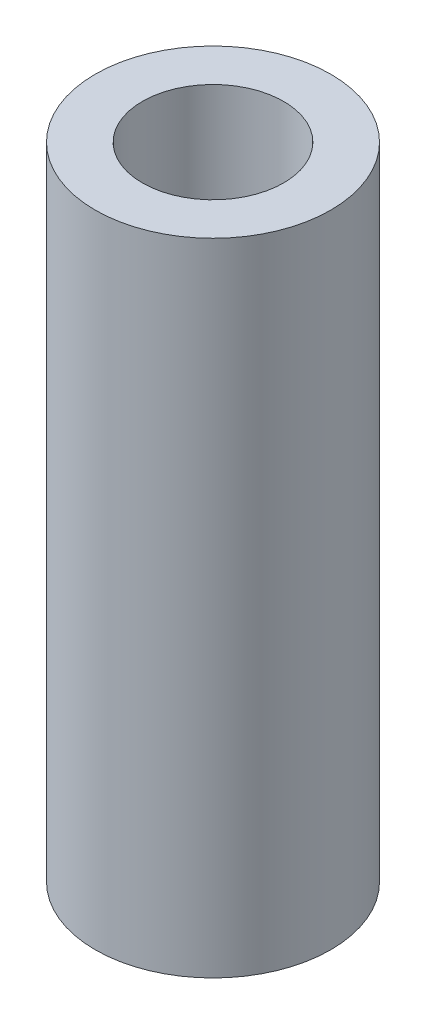
from build123d import *

# Parameters (mm, degrees)
SKETCH1_R           = 6.35
SKETCH1_R_2         = 3.81
BOSS_EXTRUDE1_DEPTH = 34.544


with BuildPart() as part:
    # Sketch1 → Boss-Extrude1 (new body)
    with BuildSketch(Plane(origin=(0, 0, 0), x_dir=(1, 0, 0), z_dir=(0, 1, 0))):
        with Locations(Location((0, 0, 0), (0, 0, 270))):
            Circle(SKETCH1_R)
        with Locations(Location((0, 0, 0), (0, 0, 270))):
            Circle(SKETCH1_R_2, mode=Mode.SUBTRACT)
    extrude(amount=BOSS_EXTRUDE1_DEPTH)


solid = part.part
